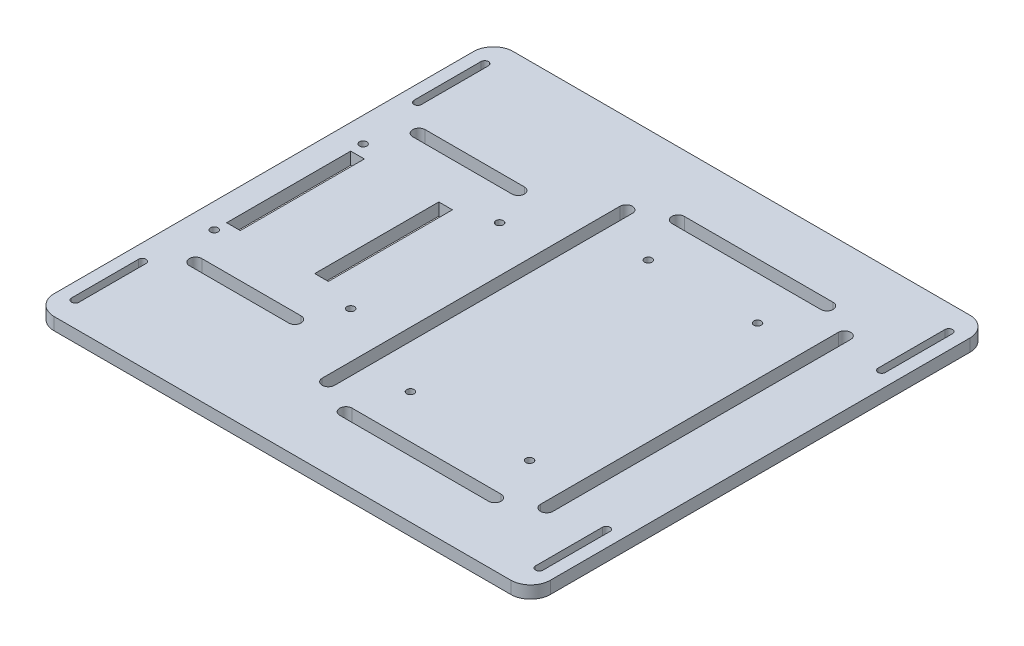
from build123d import *

# Parameters (mm, degrees)
SKETCH2_W           = 200
SKETCH2_H           = 185
BOSS_EXTRUDE1_DEPTH = 5
SKETCH3_W           = 5.5
SKETCH3_H           = 50
SKETCH3_R           = 1.5
CUT_EXTRUDE1_DEPTH  = 137.313058802
SKETCH4_R           = 1.5
CUT_EXTRUDE3_DEPTH  = 137.313058802
FILLET1_R           = 8


with BuildPart() as part:
    # Sketch2 → Boss-Extrude1 (new body)
    with BuildSketch(Plane(origin=(0, 0, 0), x_dir=(1, 0, 0), z_dir=(0, 1, 0))):
        Rectangle(SKETCH2_W, SKETCH2_H)
        with BuildLine():
            Line((-95, 55.5), (-95, 82.5))
            ThreePointArc((-95, 82.5), (-93.5, 84), (-92, 82.5))
            Line((-92, 82.5), (-92, 55.5))
            ThreePointArc((-92, 55.5), (-93.5, 54), (-95, 55.5))
        make_face(mode=Mode.SUBTRACT)
        with BuildLine():
            Line((95, 55.5), (95, 82.5))
            ThreePointArc((95, 82.5), (93.5, 84), (92, 82.5))
            Line((92, 82.5), (92, 55.5))
            ThreePointArc((92, 55.5), (93.5, 54), (95, 55.5))
        make_face(mode=Mode.SUBTRACT)
        with BuildLine():
            Line((95, -55.5), (95, -82.5))
            ThreePointArc((95, -82.5), (93.5, -84), (92, -82.5))
            Line((92, -82.5), (92, -55.5))
            ThreePointArc((92, -55.5), (93.5, -54), (95, -55.5))
        make_face(mode=Mode.SUBTRACT)
        with BuildLine():
            Line((-95, -55.5), (-95, -82.5))
            ThreePointArc((-95, -82.5), (-93.5, -84), (-92, -82.5))
            Line((-92, -82.5), (-92, -55.5))
            ThreePointArc((-92, -55.5), (-93.5, -54), (-95, -55.5))
        make_face(mode=Mode.SUBTRACT)
    extrude(amount=BOSS_EXTRUDE1_DEPTH)

    # Sketch3 → Cut-Extrude1 (cut, through all)
    with BuildSketch(Plane(origin=(0, 5, 0), x_dir=(1, 0, 0), z_dir=(0, 1, 0))):
        with BuildLine():
            Line((-82.5, 42.5), (-42.5, 42.5))
            ThreePointArc((-42.5, 42.5), (-40, 45), (-42.5, 47.5))
            Line((-42.5, 47.5), (-82.5, 47.5))
            ThreePointArc((-82.5, 47.5), (-85, 45), (-82.5, 42.5))
        make_face()
        with BuildLine():
            ThreePointArc((-42.5, -42.5), (-40, -45), (-42.5, -47.5))
            Line((-42.5, -47.5), (-82.5, -47.5))
            ThreePointArc((-82.5, -47.5), (-85, -45), (-82.5, -42.5))
            Line((-82.5, -42.5), (-42.5, -42.5))
        make_face()
        with Locations((-87.25, 0)):
            Rectangle(SKETCH3_W, SKETCH3_H)
        with Locations((-51.75, 0)):
            Rectangle(SKETCH3_W, SKETCH3_H)
        with Locations(Location((-90, -30, 0), (0, 0, 270))):
            Circle(SKETCH3_R)
        with Locations(Location((-90, 30, 0), (0, 0, 90))):
            Circle(SKETCH3_R)
        with Locations(Location((-35, -30, 0), (0, 0, 90))):
            Circle(SKETCH3_R)
        with Locations(Location((-35, 30, 0), (0, 0, 270))):
            Circle(SKETCH3_R)
    extrude(amount=-CUT_EXTRUDE1_DEPTH, mode=Mode.SUBTRACT)

    # Sketch4 → Cut-Extrude3 (cut, through all)
    with BuildSketch(Plane(origin=(0, 5, 0), x_dir=(1, 0, 0), z_dir=(0, 1, 0))):
        with Locations(Location((8, 46.935, 0), (0, 0, 270))):
            Circle(SKETCH4_R)
        with Locations(Location((52, 46.935, 0), (0, 0, 90))):
            Circle(SKETCH4_R)
        with Locations(Location((6, -46.935, 0), (0, 0, 270))):
            Circle(SKETCH4_R)
        with Locations(Location((54, -46.935, 0), (0, 0, 90))):
            Circle(SKETCH4_R)
        with BuildLine():
            Line((71.5, -60), (71.5, 60))
            ThreePointArc((71.5, 60), (74, 62.5), (76.5, 60))
            Line((76.5, 60), (76.5, -60))
            ThreePointArc((76.5, -60), (74, -62.5), (71.5, -60))
        make_face()
        with BuildLine():
            Line((-16.5, -60), (-16.5, 60))
            ThreePointArc((-16.5, 60), (-14, 62.5), (-11.5, 60))
            Line((-11.5, 60), (-11.5, -60))
            ThreePointArc((-11.5, -60), (-14, -62.5), (-16.5, -60))
        make_face()
        with BuildLine():
            Line((0, 69.435), (60, 69.435))
            ThreePointArc((60, 69.435), (62.5, 66.935), (60, 64.435))
            Line((60, 64.435), (0, 64.435))
            ThreePointArc((0, 64.435), (-2.5, 66.935), (0, 69.435))
        make_face()
        with BuildLine():
            Line((0, -69.435), (60, -69.435))
            ThreePointArc((60, -69.435), (62.5, -66.935), (60, -64.435))
            Line((60, -64.435), (0, -64.435))
            ThreePointArc((0, -64.435), (-2.5, -66.935), (0, -69.435))
        make_face()
    extrude(amount=-CUT_EXTRUDE3_DEPTH, mode=Mode.SUBTRACT)

    # Fillet1
    fillet1_edges = [part.edges().sort_by_distance(p)[0] for p in [
        (100, 2.5, 92.5),
        (-100, 2.5, 92.5),
        (-100, 2.5, -92.5),
        (100, 2.5, -92.5),
    ]]
    fillet(fillet1_edges, radius=FILLET1_R)


solid = part.part
